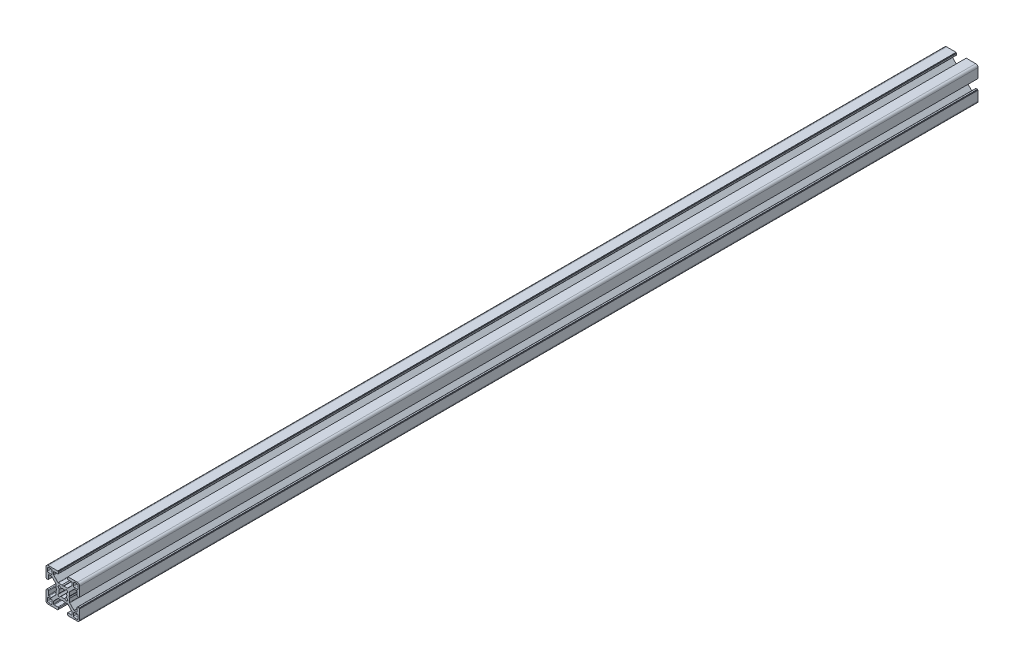
from build123d import *

# Parameters (mm, degrees)
BOSS_EXTRUDE1_DEPTH = 400
CIRPATTERN1_COUNT   = 4


with BuildPart() as part:
    # Sketch3 → Boss-Extrude1 (new, symmetric)
    with BuildSketch(Plane.XY):
        with BuildLine():
            Line((-4.503841895, 3.156803476), (-3.14772708, 1.530298739))
            ThreePointArc((-3.14772708, 1.530298739), (-3.410794979, 0.785160882), (-3.5, 0))
            Line((-3.5, 0), (-5.5, 0))
            Line((-5.5, 0), (-6, 0.866025404))
            Line((-6, 0.866025404), (-6, 3.996841995))
            ThreePointArc((-6, 3.996841995), (-6.038060234, 4.188183711), (-6.146446609, 4.350395385))
            Line((-6.146446609, 4.350395385), (-9.917104615, 8.121053391))
            ThreePointArc((-9.917104615, 8.121053391), (-10.079316289, 8.229439766), (-10.270658005, 8.2675))
            Line((-10.270658005, 8.2675), (-12.29, 8.2675))
            ThreePointArc((-12.29, 8.2675), (-12.643553391, 8.121053391), (-12.79, 7.7675))
            Line((-12.79, 7.7675), (-12.79, 4.5))
            ThreePointArc((-12.79, 4.5), (-12.936446609, 4.146446609), (-13.29, 4))
            Line((-13.29, 4), (-14.5, 4))
            Line((-14.5, 4), (-14.5, 4.5))
            Line((-14.5, 4.5), (-15, 4.5))
            Line((-15, 4.5), (-15, 12.968))
            ThreePointArc((-15, 12.968), (-14.404840979, 14.404840979), (-12.968, 15))
            Line((-12.968, 15), (-4.5, 15))
            Line((-4.5, 15), (-4.5, 14.5))
            Line((-4.5, 14.5), (-4, 14.5))
            Line((-4, 14.5), (-4, 13.29))
            ThreePointArc((-4, 13.29), (-4.146446609, 12.936446609), (-4.5, 12.79))
            Line((-4.5, 12.79), (-7.7675, 12.79))
            ThreePointArc((-7.7675, 12.79), (-8.121053391, 12.643553391), (-8.2675, 12.29))
            Line((-8.2675, 12.29), (-8.2675, 10.270658005))
            ThreePointArc((-8.2675, 10.270658005), (-8.229439766, 10.079316289), (-8.121053391, 9.917104615))
            Line((-8.121053391, 9.917104615), (-4.350395385, 6.146446609))
            ThreePointArc((-4.350395385, 6.146446609), (-4.188183711, 6.038060234), (-3.996841995, 6))
            Line((-3.996841995, 6), (-0.866025404, 6))
            Line((-0.866025404, 6), (0, 5.5))
            Line((0, 5.5), (0, 3.5))
            ThreePointArc((0, 3.5), (-0.785160882, 3.410794979), (-1.530298739, 3.14772708))
            Line((-1.530298739, 3.14772708), (-3.156803476, 4.503841895))
            ThreePointArc((-3.156803476, 4.503841895), (-3.889087297, 3.889087297), (-4.503841895, 3.156803476))
        make_face()
        with BuildLine():
            Line((-12.705, 9.5135), (-10.5135, 9.5135))
            ThreePointArc((-10.5135, 9.5135), (-9.806393219, 9.806393219), (-9.5135, 10.5135))
            Line((-9.5135, 10.5135), (-9.5135, 12.705))
            ThreePointArc((-9.5135, 12.705), (-9.806393219, 13.412106781), (-10.5135, 13.705))
            Line((-10.5135, 13.705), (-12.705, 13.705))
            ThreePointArc((-12.705, 13.705), (-13.412106781, 13.412106781), (-13.705, 12.705))
            Line((-13.705, 12.705), (-13.705, 10.5135))
            ThreePointArc((-13.705, 10.5135), (-13.412106781, 9.806393219), (-12.705, 9.5135))
        make_face(mode=Mode.SUBTRACT)
    boss_extrude1 = extrude(amount=BOSS_EXTRUDE1_DEPTH, both=True)

    # CirPattern1: Boss-Extrude1 ×4 about axis
    cirpattern1_axis = Axis((0, 0, 0), (0, 0, 1))
    for i in range(1, CIRPATTERN1_COUNT):
        add(boss_extrude1.rotate(cirpattern1_axis, i * 360 / CIRPATTERN1_COUNT))


solid = part.part
